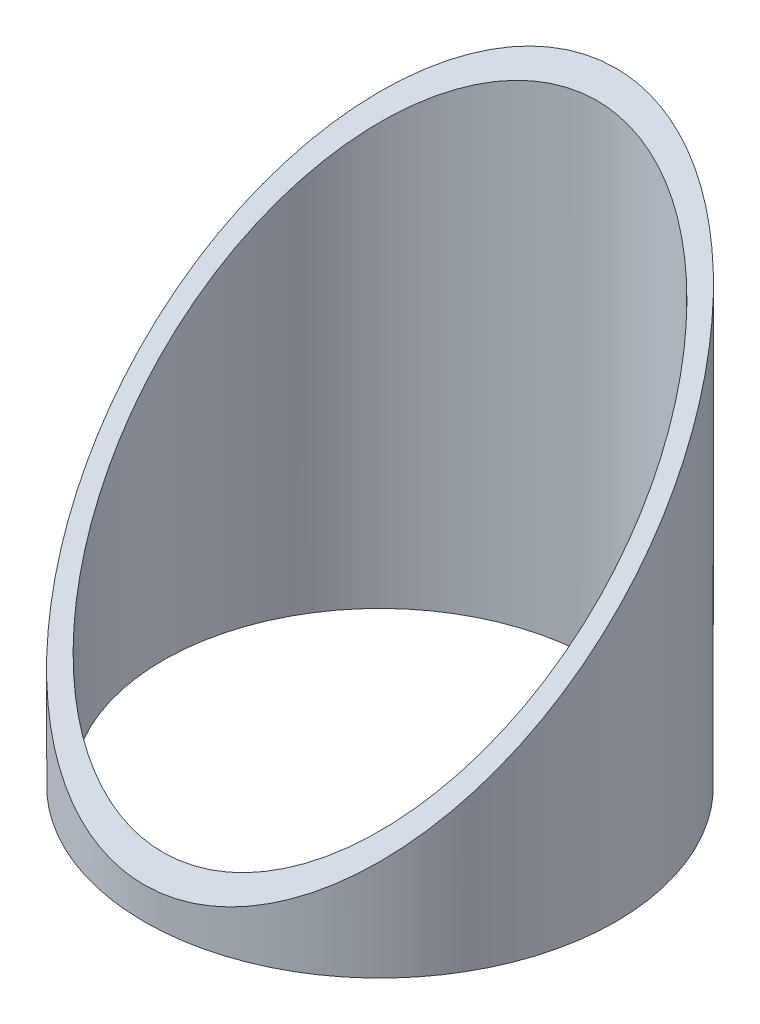
from build123d import *

# Parameters (mm, degrees)
SKETCH2_R               = 20
BOSS_EXTRUDE1_DEPTH     = 0.707106781
SKETCH3_R               = 7.4
SKETCH3_R_2             = 5.9
BOSS_EXTRUDE2_DEPTH     = 1
CUT_EXTRUDE1_DEPTH      = 48.148112734
CUT_EXTRUDE1_DEPTH_BACK = 48.148112734
SKETCH4_W               = 305.220008054
SKETCH4_H               = 126.870977102
SKETCH4_R               = 6.4
BOSS_EXTRUDE3_REACH     = 25.052
SKETCH5_R               = 6.28
SKETCH5_R_2             = 5.78
SKETCH7_R               = 18.282703858
CUT_EXTRUDE3_DEPTH      = 0.707106781
SKETCH8_R               = 12.772794789
CUT_EXTRUDE4_DEPTH      = 2.52


with BuildPart() as part:
    # Sketch2 → Boss-Extrude1 (new body)
    with BuildSketch(Plane(origin=(0, 0, 0), x_dir=(1, 0, 0), z_dir=(0, 0.7071067811865464, 0.7071067811865488))):
        with Locations(Location((0, 20, 0), (0, 0, 270))):
            Circle(SKETCH2_R)
    extrude(amount=-BOSS_EXTRUDE1_DEPTH)

    # Sketch4 → Cut-Extrude1 (cut, two sides: drawn at the far end of the back side and taken through both)
    with BuildSketch(Plane.XZ.offset(3.25).offset(-CUT_EXTRUDE1_DEPTH_BACK)):
        with Locations((6.754756468, -15.87939177)):
            Rectangle(SKETCH4_W, SKETCH4_H)
        with Locations(Location((0, -7.4, 0), (0, 0, 90))):
            Circle(SKETCH4_R, mode=Mode.SUBTRACT)
    extrude(amount=CUT_EXTRUDE1_DEPTH + CUT_EXTRUDE1_DEPTH_BACK, mode=Mode.SUBTRACT)

    # Sketch7 → Cut-Extrude3 (cut)
    with BuildSketch(Plane(origin=(0, 0, 0), x_dir=(1, 0, 0), z_dir=(0, 0.7071067811865465, 0.7071067811865487))):
        with Locations((0, 10.465180362)):
            Circle(SKETCH7_R)
    extrude(amount=-CUT_EXTRUDE3_DEPTH, mode=Mode.SUBTRACT)


with BuildPart() as body_2:
    # Sketch3 → Boss-Extrude2 (new body)
    with BuildSketch(Plane(origin=(0, -3.25, 0), x_dir=(1, 0, 0), z_dir=(0, 1, 0))):
        with Locations(Location((0, 7.4, 0), (0, 0, 270))):
            Circle(SKETCH3_R)
        with Locations(Location((0, 7.4, 0), (0, 0, 270))):
            Circle(SKETCH3_R_2, mode=Mode.SUBTRACT)
    extrude(amount=BOSS_EXTRUDE2_DEPTH)


with BuildPart() as body_3:
    # Boss-Extrude3: up to this plane
    boss_extrude3_end = Plane(origin=(0, 13.642135624, -14.642135624), z_dir=(0, 0.7071067811865464, 0.7071067811865488))
    # Sketch5 → Boss-Extrude3 (new, up to the surface)
    with BuildSketch(Plane(origin=(0, -2.25, 0), x_dir=(1, 0, 0), z_dir=(0, 1, 0)), mode=Mode.PRIVATE) as boss_extrude3_sk1:
        with Locations(Location((0, 7.4, 0), (0, 0, 270))):
            Circle(SKETCH5_R)
        with Locations(Location((0, 7.4, 0), (0, 0, 270))):
            Circle(SKETCH5_R_2, mode=Mode.SUBTRACT)
    boss_extrude3_tool1 = split(extrude(boss_extrude3_sk1.sketch, amount=BOSS_EXTRUDE3_REACH, mode=Mode.PRIVATE), bisect_by=boss_extrude3_end, keep=Keep.BOTH, mode=Mode.PRIVATE)
    add(boss_extrude3_tool1.solids().sort_by_distance((0, -2.25, -13.502375))[0])


with BuildPart() as cut_extrude4_tool:
    # Sketch8 → Cut-Extrude4 (new body)
    with BuildSketch(Plane.XZ.offset(3.25)):
        with Locations((0, -7.395337102)):
            Circle(SKETCH8_R)
    extrude(amount=-CUT_EXTRUDE4_DEPTH)


with BuildPart() as body_2_1:
    add(body_2.part)

    # Cut-Extrude4: cut by cut_extrude4_tool
    add(cut_extrude4_tool.part, mode=Mode.SUBTRACT)


with BuildPart() as body_3_1:
    add(body_3.part)

    # Cut-Extrude4: cut by cut_extrude4_tool
    add(cut_extrude4_tool.part, mode=Mode.SUBTRACT)


solid = body_3_1.part
